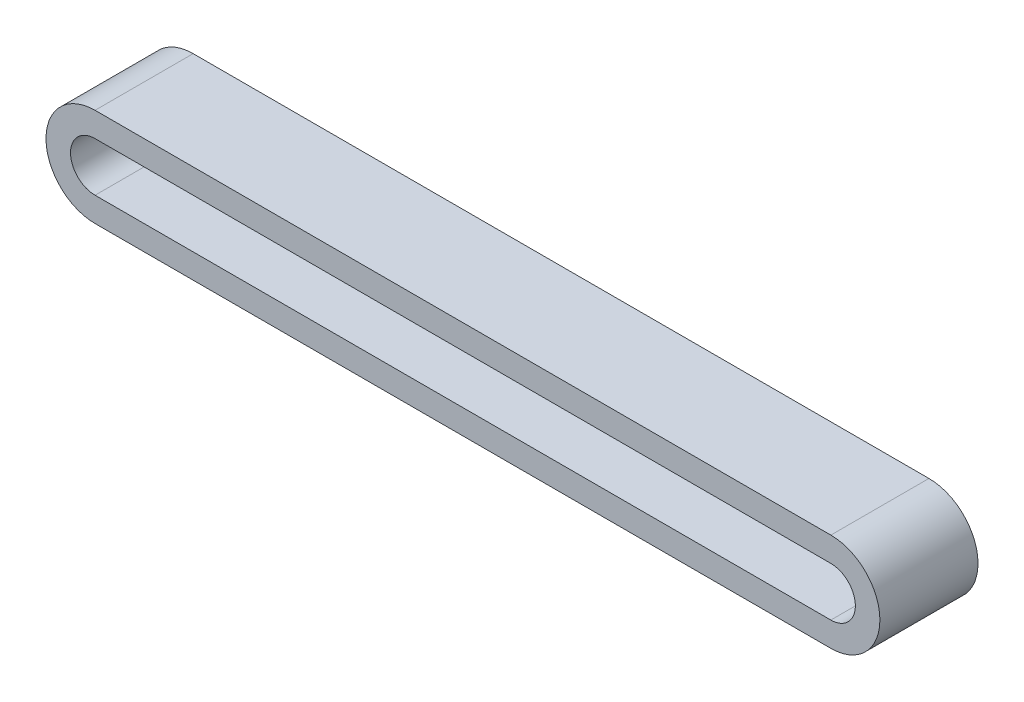
from build123d import *

# Parameters (mm, degrees)
SALIENTE_EXTRUIR1_DEPTH = 20


with BuildPart() as part:
    # Croquis1 → Saliente-Extruir1 (new body)
    with BuildSketch(Plane.XY):
        with BuildLine():
            Line((75, -10), (-75, -10))
            ThreePointArc((-75, -10), (-85, 0), (-75, 10))
            Line((-75, 10), (75, 10))
            ThreePointArc((75, 10), (85, 0), (75, -10))
        make_face()
        with BuildLine():
            Line((-75, 5), (75, 5))
            ThreePointArc((75, 5), (80, 0), (75, -5))
            Line((75, -5), (-75, -5))
            ThreePointArc((-75, -5), (-80, 0), (-75, 5))
        make_face(mode=Mode.SUBTRACT)
    extrude(amount=SALIENTE_EXTRUIR1_DEPTH)


solid = part.part
